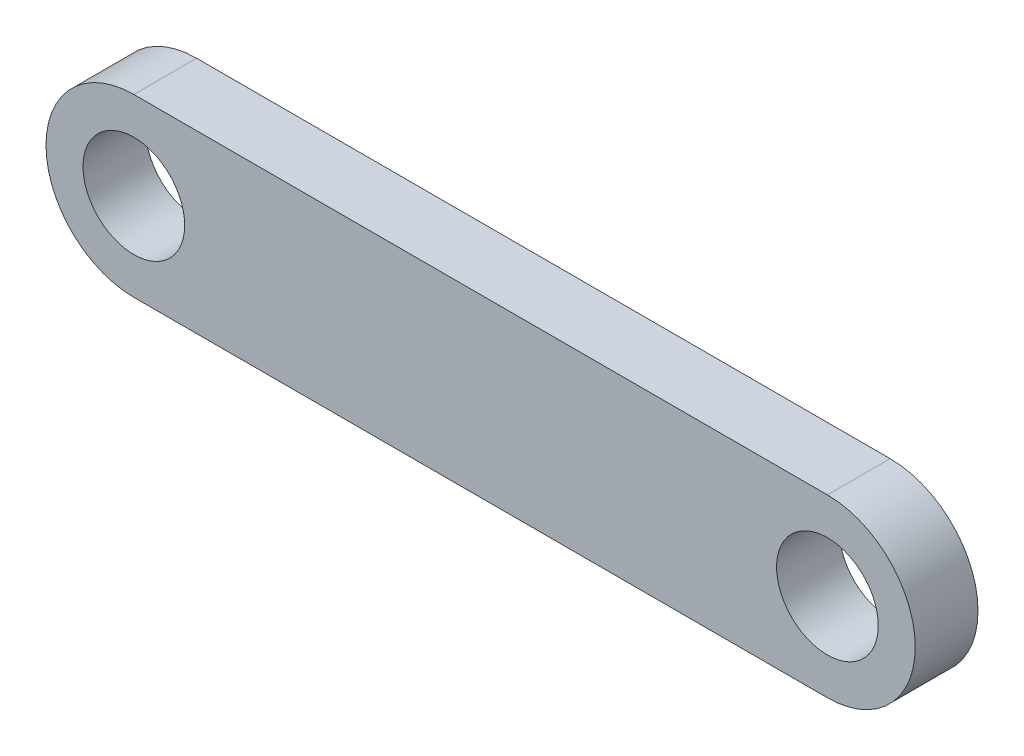
from build123d import *

# Parameters (mm, degrees)
EXTRUDE_1_DEPTH = 5


with BuildPart() as part:
    # 草图1 → 凸台-拉伸1 (new body)
    with BuildSketch(Plane.XY):
        with BuildLine():
            ThreePointArc((0, 7), (4.949747468, 4.949747468), (7, 0))
            Line((7, 0), (48.26, 0))
            ThreePointArc((48.26, 0), (50.310252532, 4.949747468), (55.26, 7))
            Line((55.26, 7), (0, 7))
        make_face()
        with BuildLine():
            ThreePointArc((55.26, 7), (50.310252532, 4.949747468), (48.26, 0))
            Line((48.26, 0), (51.21, 0))
            ThreePointArc((51.21, 0), (55.26, 4.05), (59.31, 0))
            Line((59.31, 0), (62.26, 0))
            ThreePointArc((62.26, 0), (60.209747468, 4.949747468), (55.26, 7))
        make_face()
        with BuildLine():
            Line((51.21, 0), (48.26, 0))
            ThreePointArc((48.26, 0), (50.310252532, -4.949747468), (55.26, -7))
            ThreePointArc((55.26, -7), (60.209747468, -4.949747468), (62.26, 0))
            Line((62.26, 0), (59.31, 0))
            ThreePointArc((59.31, 0), (55.26, -4.05), (51.21, 0))
        make_face()
        with BuildLine():
            Line((48.26, 0), (7, 0))
            ThreePointArc((7, 0), (4.949747468, -4.949747468), (0, -7))
            Line((0, -7), (55.26, -7))
            ThreePointArc((55.26, -7), (50.310252532, -4.949747468), (48.26, 0))
        make_face()
        with BuildLine():
            ThreePointArc((-4.05, 0), (0, 4.05), (4.05, 0))
            Line((4.05, 0), (7, 0))
            ThreePointArc((7, 0), (4.949747468, 4.949747468), (0, 7))
            ThreePointArc((0, 7), (-4.949747468, 4.949747468), (-7, 0))
            Line((-7, 0), (-4.05, 0))
        make_face()
        with BuildLine():
            Line((7, 0), (4.05, 0))
            ThreePointArc((4.05, 0), (0, -4.05), (-4.05, 0))
            Line((-4.05, 0), (-7, 0))
            ThreePointArc((-7, 0), (-4.949747468, -4.949747468), (0, -7))
            ThreePointArc((0, -7), (4.949747468, -4.949747468), (7, 0))
        make_face()
    extrude(amount=EXTRUDE_1_DEPTH)


solid = part.part
